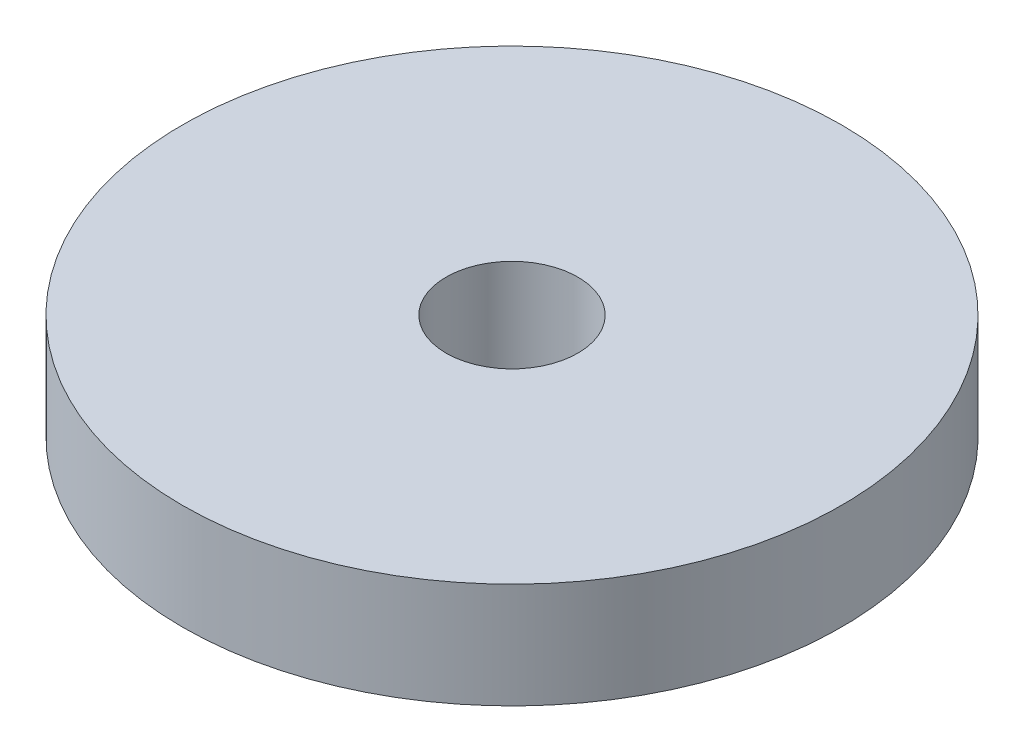
from build123d import *

# Parameters (mm, degrees)
SKETCH1_R           = 15.875
SKETCH1_R_2         = 3.175
BOSS_EXTRUDE1_DEPTH = 5.08


with BuildPart() as part:
    # Sketch1 → Boss-Extrude1 (new body)
    with BuildSketch(Plane(origin=(0, 0, 0), x_dir=(1, 0, 0), z_dir=(0, 1, 0))):
        with Locations(Location((0, 0, 0), (0, 0, 270))):
            Circle(SKETCH1_R)
        with Locations(Location((0, 0, 0), (0, 0, 270))):
            Circle(SKETCH1_R_2, mode=Mode.SUBTRACT)
    extrude(amount=BOSS_EXTRUDE1_DEPTH)


solid = part.part
